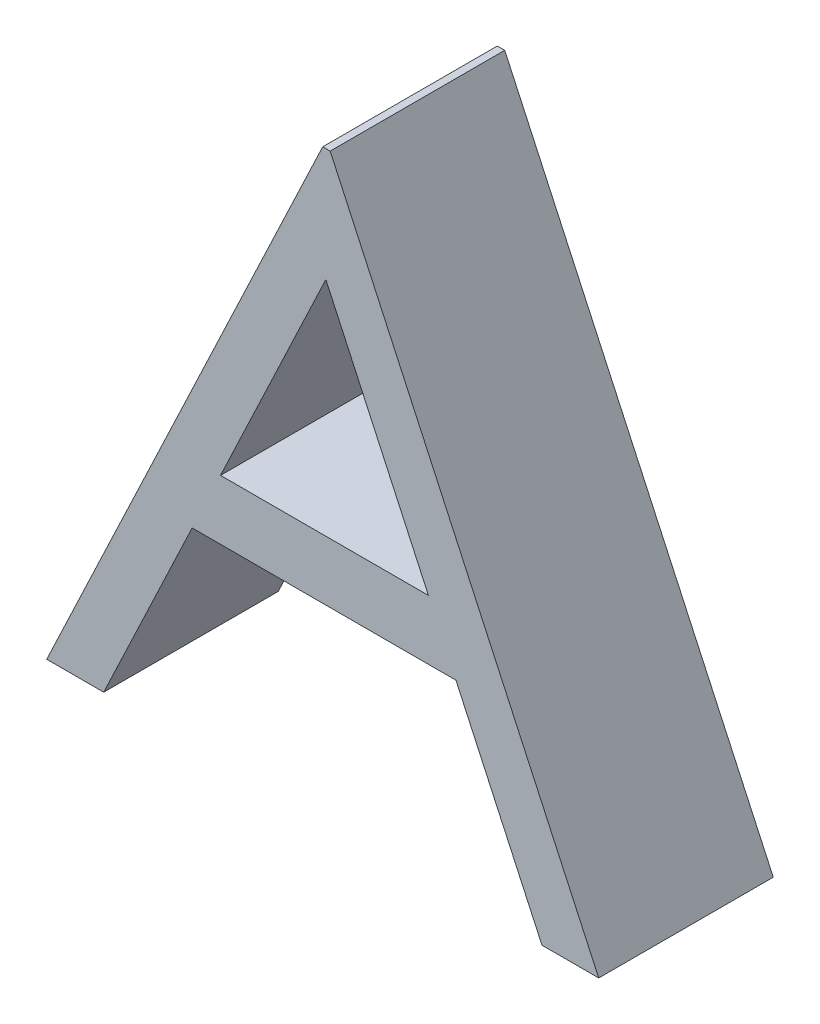
from build123d import *

# Parameters (mm, degrees)
BOSS_EXTRU_1_DEPTH = 1.5


with BuildPart() as part:
    # Esquisse1 → Boss.-Extru.1 (new body)
    with BuildSketch(Plane.XY):
        Polygon((-53.381183275, -17.870119076), (-51.073490967, -22.870119076), (-51.561271416, -22.870119076), (-52.300454108, -21.267554974), (-54.56708071, -21.267554974), (-55.327297057, -22.870119076), (-55.81708071, -22.870119076), (-53.445285839, -17.870119076), align=None)
        Polygon((-53.418242569, -18.844678371), (-54.323691287, -20.754734461), (-52.536832313, -20.754734461), align=None, mode=Mode.SUBTRACT)
    extrude(amount=BOSS_EXTRU_1_DEPTH)


solid = part.part
